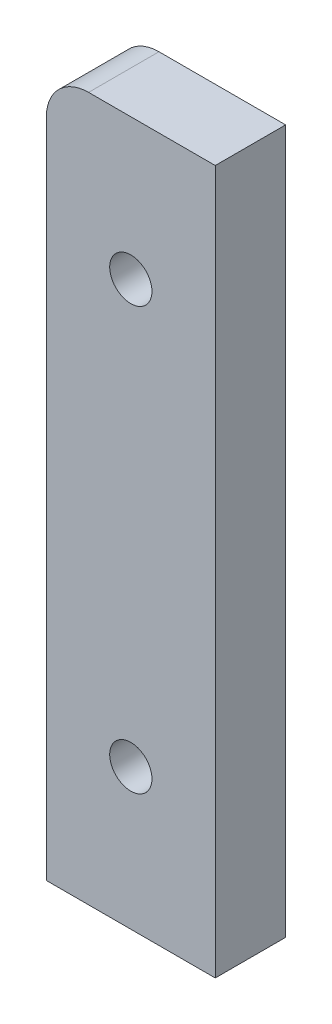
from build123d import *

# Parameters (mm, degrees)
SKETCH_1_W          = 12
SKETCH_1_H          = 50
EXTRUDE_1_DEPTH     = 5
SKETCH_2_R          = 1.5
CUT_EXTRUDE_1_DEPTH = 27.191601707
FILLET_2_R          = 3


with BuildPart() as part:
    # 草图1 → 凸台-拉伸1 (new body)
    with BuildSketch(Plane.XY):
        Rectangle(SKETCH_1_W, SKETCH_1_H)
    extrude(amount=EXTRUDE_1_DEPTH)

    # 草图2 → 切除-拉伸1 (cut, through all)
    with BuildSketch(Plane.XY.offset(5)):
        with Locations((0, 15)):
            Circle(SKETCH_2_R)
    cut_extrude_1 = extrude(amount=-CUT_EXTRUDE_1_DEPTH, mode=Mode.SUBTRACT)

    # 镜向1: 切除-拉伸1 across plane
    add(cut_extrude_1.mirror(Plane.ZX), mode=Mode.SUBTRACT)

    # 圆角2
    fillet_2_edges = [part.edges().sort_by_distance(p)[0] for p in [
        (-6, 25, 2.5),
    ]]
    fillet(fillet_2_edges, radius=FILLET_2_R)


solid = part.part
